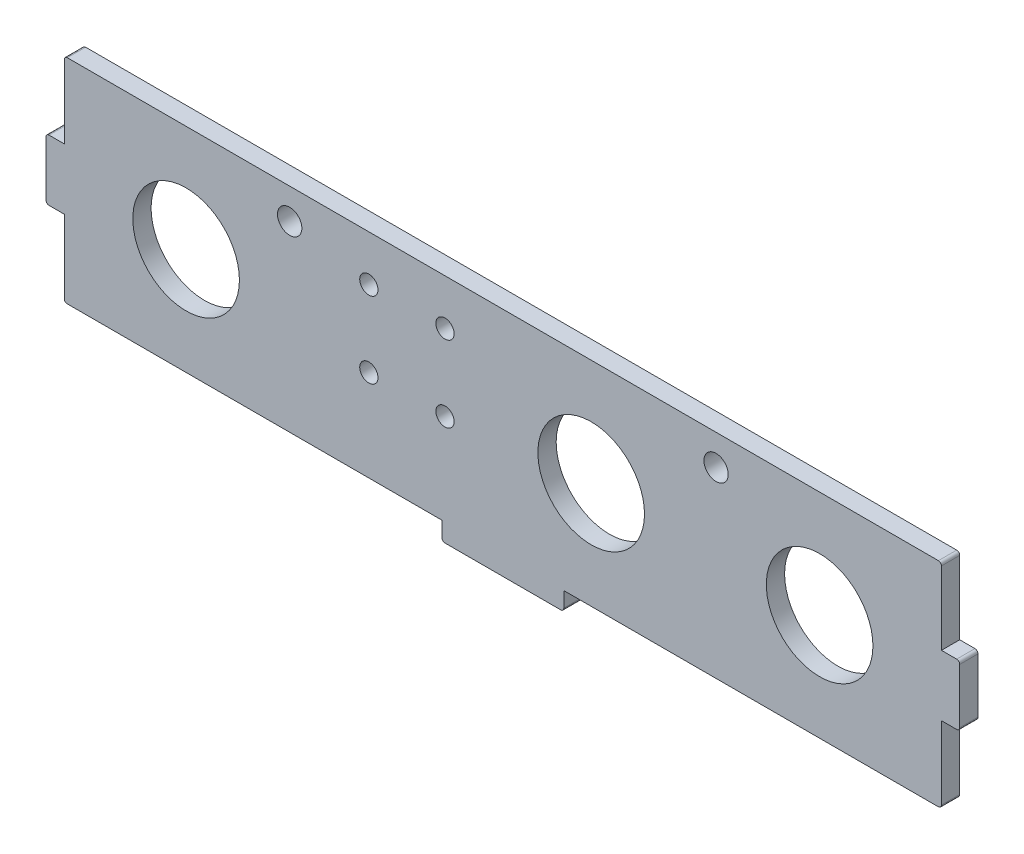
from build123d import *

# Parameters (mm, degrees)
SKETCH1_W           = 300
SKETCH1_H           = 70
FRONT_DEPTH         = 6
SKETCH2_W           = 6
SKETCH2_H           = 25
SKETCH2_R           = 4
MOUNT_DEPTH         = 309.116860947
SKETCH3_W           = 40
SKETCH3_H           = 6
BOSS_EXTRUDE1_DEPTH = 6
FILLET_2_R          = 1
SKETCH4_R           = 3
CUT_EXTRUDE1_DEPTH  = 309.116860947
LITE_REACH          = 310.117
SKETCH5_R           = 17.5


with BuildPart() as part:
    # Sketch1 → front (new body)
    with BuildSketch(Plane.XY):
        with Locations((150, 35)):
            Rectangle(SKETCH1_W, SKETCH1_H)
    extrude(amount=-FRONT_DEPTH)

    # Sketch2 → mount (cut, through all)
    with BuildSketch(Plane.XY):
        with Locations((3, 57.5)):
            Rectangle(SKETCH2_W, SKETCH2_H)
        with Locations((3, 12.5)):
            Rectangle(SKETCH2_W, SKETCH2_H)
        with Locations((297, 57.5)):
            Rectangle(SKETCH2_W, SKETCH2_H)
        with Locations((297, 12.5)):
            Rectangle(SKETCH2_W, SKETCH2_H)
        with Locations((80, 60)):
            Circle(SKETCH2_R)
        with Locations((220, 60)):
            Circle(SKETCH2_R)
    extrude(amount=-MOUNT_DEPTH, mode=Mode.SUBTRACT)

    # Sketch3 → Boss-Extrude1 (add)
    with BuildSketch(Plane.XY):
        with Locations((150, -3)):
            Rectangle(SKETCH3_W, SKETCH3_H)
    extrude(amount=-BOSS_EXTRUDE1_DEPTH)

    # fillet 2
    fillet_2_edges = [part.edges().sort_by_distance(p)[0] for p in [
        (0, 45, -3),
        (0, 25, -3),
        (294, 0, -3),
        (300, 25, -3),
        (300, 45, -3),
        (294, 70, -3),
        (6, 0, -3),
        (6, 70, -3),
        (170, -6, -3),
        (130, -6, -3),
    ]]
    fillet(fillet_2_edges, radius=FILLET_2_R)

    # Sketch4 → Cut-Extrude1 (cut, through all)
    with BuildSketch(Plane.XY):
        with Locations((106, 55)):
            Circle(SKETCH4_R)
        with Locations((131, 55)):
            Circle(SKETCH4_R)
        with Locations((106, 30)):
            Circle(SKETCH4_R)
        with Locations((131, 30)):
            Circle(SKETCH4_R)
    extrude(amount=-CUT_EXTRUDE1_DEPTH, mode=Mode.SUBTRACT)

    # Sketch5 → lite (cut, up to next)
    with BuildSketch(Plane.XY, mode=Mode.PRIVATE) as lite_sk1:
        with Locations((46, 35)):
            Circle(SKETCH5_R)
    lite_tool1 = extrude(lite_sk1.sketch, amount=-LITE_REACH, mode=Mode.PRIVATE) & part.part
    # Sketch5 → lite (cut, up to next)
    with BuildSketch(Plane.XY, mode=Mode.PRIVATE) as lite_sk2:
        with Locations((179, 35)):
            Circle(SKETCH5_R)
    lite_tool2 = extrude(lite_sk2.sketch, amount=-LITE_REACH, mode=Mode.PRIVATE) & part.part
    # Sketch5 → lite (cut, up to next)
    with BuildSketch(Plane.XY, mode=Mode.PRIVATE) as lite_sk3:
        with Locations((254, 35)):
            Circle(SKETCH5_R)
    lite_tool3 = extrude(lite_sk3.sketch, amount=-LITE_REACH, mode=Mode.PRIVATE) & part.part
    add(lite_tool1.solids().sort_by_distance((46, 35, 0))[0], mode=Mode.SUBTRACT)
    add(lite_tool2.solids().sort_by_distance((179, 35, 0))[0], mode=Mode.SUBTRACT)
    add(lite_tool3.solids().sort_by_distance((254, 35, 0))[0], mode=Mode.SUBTRACT)


solid = part.part
